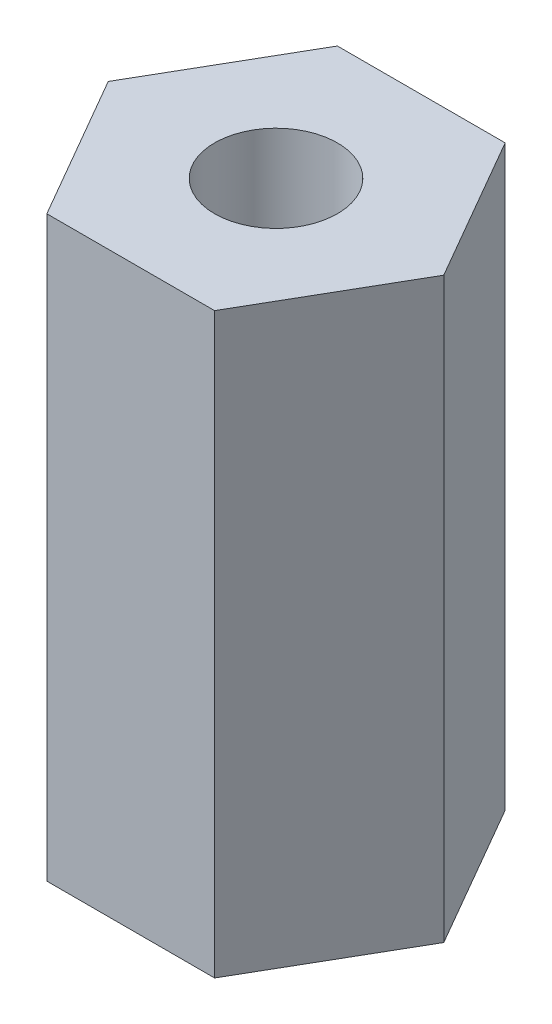
from build123d import *

# Parameters (mm, degrees)
BOSS_EXTRUDE1_DEPTH = 12.73
SKETCH3_R           = 1.35255
CUT_EXTRUDE1_DEPTH  = 6
SKETCH4_R           = 0.353459893
CUT_EXTRUDE2_DEPTH  = 1


with BuildPart() as part:
    # Sketch1 → Boss-Extrude1 (new body)
    with BuildSketch(Plane(origin=(0, 0, 0), x_dir=(1, 0, 0), z_dir=(0, 1, 0))):
        Polygon((-3.695041723, 0), (-1.847520861, -3.2), (1.847520861, -3.2), (3.695041723, 0), (1.847520861, 3.2), (-1.847520861, 3.2), align=None)
    extrude(amount=BOSS_EXTRUDE1_DEPTH)

    # Sketch3 → Cut-Extrude1 (cut)
    with BuildSketch(Plane(origin=(0, 12.73, 0), x_dir=(1, 0, 0), z_dir=(0, 1, 0))):
        with Locations(Location((0, 0, 0), (0, 0, 270))):
            Circle(SKETCH3_R)
    extrude(amount=-CUT_EXTRUDE1_DEPTH, mode=Mode.SUBTRACT)

    # Sketch4 → Cut-Extrude2 (cut)
    with BuildSketch(Plane.XZ):
        with Locations(Location((0, 0, 0), (0, 0, 270))):
            Circle(SKETCH4_R)
    extrude(amount=-CUT_EXTRUDE2_DEPTH, mode=Mode.SUBTRACT)


solid = part.part
